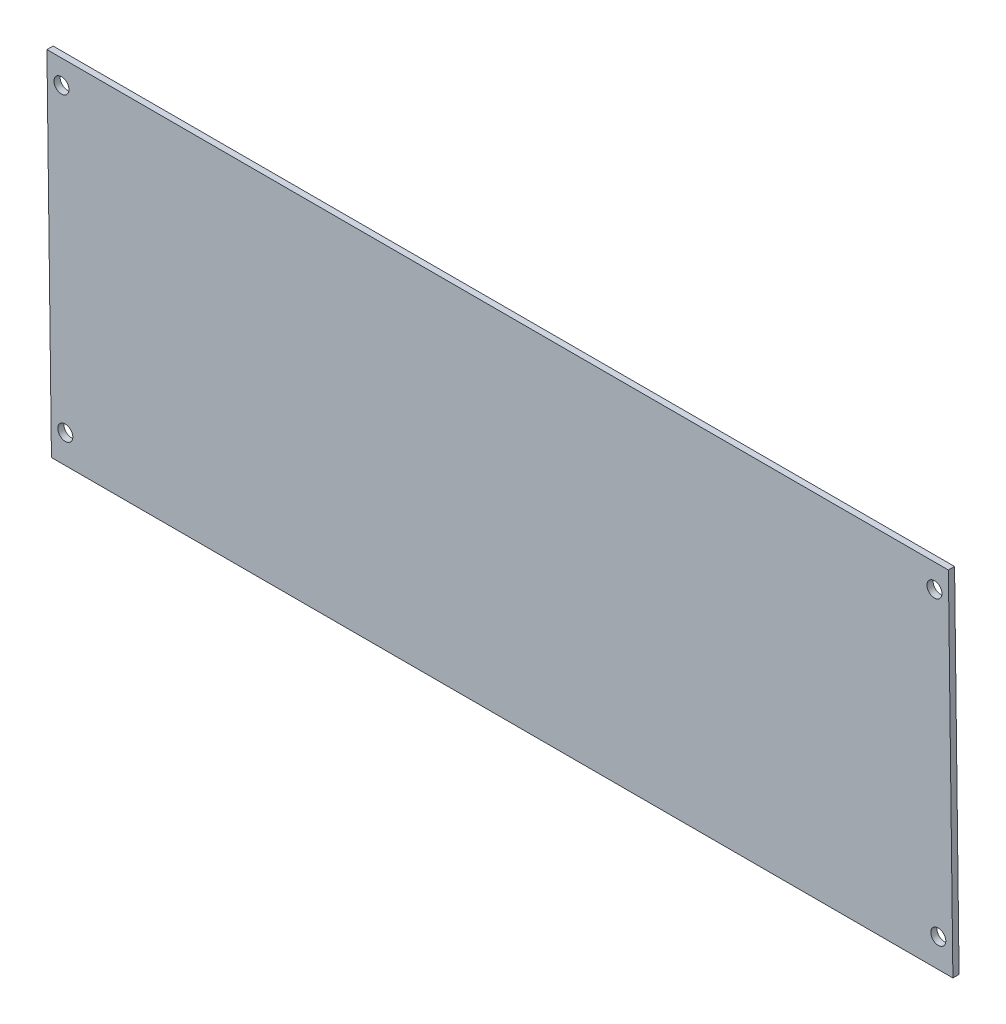
from build123d import *

# Parameters (mm, degrees)
BOSS_EXTRUDE1_DEPTH     = 1.3
SKETCH3_R               = 1.585
CUT_EXTRUDE4_DEPTH      = 5
SKETCH8_W               = 195
SKETCH8_H               = 1.3
CUT_EXTRUDE5_DEPTH      = 10
CUT_EXTRUDE6_DEPTH      = 3
CUT_EXTRUDE6_DEPTH_BACK = 1
SKETCH9_W               = 190.999999892
SKETCH9_H               = 1.3


with BuildPart() as part:
    # Sketch1 → Boss-Extrude1 (new body)
    with BuildSketch(Plane.XY):
        Polygon((-3.499999892, 110.115018053), (-0.999999892, 110.115018053), (0, 32.121428571), (190, 32.121428571), (189, 110.121428571), (191.500000108, 110.115018053), (191.500000108, 115.115018053), (-3.499999892, 115.115018053), align=None)
    extrude(amount=BOSS_EXTRUDE1_DEPTH)

    # Sketch3 → Cut-Extrude4 (cut)
    with BuildSketch(Plane.XY.offset(1.3)):
        with Locations((186.063938212, 105.115018053)):
            Circle(SKETCH3_R)
        with Locations((2.064354513, 105.115018053)):
            Circle(SKETCH3_R)
        with Locations((2.872030927, 42.121428571)):
            Circle(SKETCH3_R)
        with Locations((186.871548334, 42.121428571)):
            Circle(SKETCH3_R)
    extrude(amount=-CUT_EXTRUDE4_DEPTH, mode=Mode.SUBTRACT)

    # Sketch8 → Cut-Extrude5 (cut)
    with BuildSketch(Plane(origin=(0, 110.115018053, 0), x_dir=(1, 0, 0), z_dir=(0, 1, 0))):
        with Locations((94.000000108, -0.65)):
            Rectangle(SKETCH8_W, SKETCH8_H)
    extrude(amount=CUT_EXTRUDE5_DEPTH, mode=Mode.SUBTRACT)

    # Sketch9 → Cut-Extrude6 (cut, two sides: drawn at the far end of the back side and taken through both)
    with BuildSketch(Plane(origin=(0, 35.121428571, 0), x_dir=(-1, 0, 0), z_dir=(0, -1, 0)).offset(-CUT_EXTRUDE6_DEPTH_BACK)):
        with Locations((-94.500000054, -0.65)):
            Rectangle(SKETCH9_W, SKETCH9_H)
    extrude(amount=CUT_EXTRUDE6_DEPTH + CUT_EXTRUDE6_DEPTH_BACK, mode=Mode.SUBTRACT)


solid = part.part
